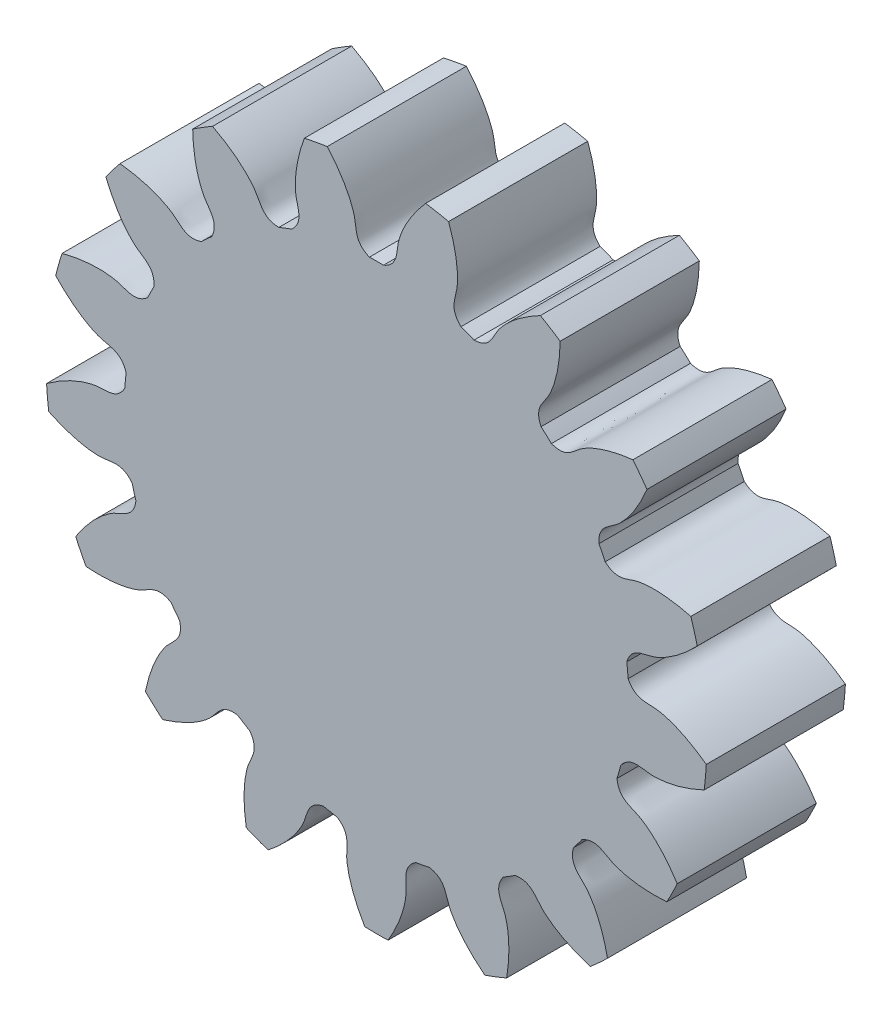
from build123d import *

# Parameters (mm, degrees)
SKETCH_1_R               = 9.5
EXTRUDE_1_DEPTH          = 4
CUT_EXTRUDE_1_DEPTH      = 15.017845769
PATTERN_CIRCULAR_1_COUNT = 17


with BuildPart() as part:
    # 草图1 → 凸台-拉伸1 (new body)
    with BuildSketch(Plane.XY):
        Circle(SKETCH_1_R)
    extrude(amount=EXTRUDE_1_DEPTH)

    # 草图2 → 切除-拉伸1 (cut, through all)
    with BuildSketch(Plane.XY):
        with BuildLine():
            ThreePointArc((0.201693747, 7.247193914), (0, 7.25), (-0.201693747, 7.247193914))
            add(Edge.make_bspline(
                [(-0.201693747, 7.247193914), (-0.62787974, 7.424822021), (-0.566195378, 7.754813407), (-0.638305605, 8.064824138), (-0.644975734, 8.091150595), (-0.653018503, 8.120419314), (-0.66255059, 8.152585333), (-0.673691778, 8.187599364), (-0.68655908, 8.225408757), (-0.701268445, 8.265957251), (-0.717934112, 8.309185094), (-0.736668679, 8.355029064), (-0.757582964, 8.40342252), (-0.780785927, 8.454295441), (-0.806384576, 8.507574481), (-0.834483875, 8.563183015), (-0.865186662, 8.621041194), (-0.898593556, 8.681066), (-0.934802876, 8.7431713), (-0.973910555, 8.80726791), (-1.016010058, 8.873263654), (-1.0611923, 8.941063427), (-1.109545569, 9.010569262), (-1.161155445, 9.081680395), (-1.216104726, 9.154293339), (-1.274473352, 9.228301949), (-1.336338335, 9.303597503), (-1.401773683, 9.380068769), (-1.470850337, 9.45760209), (-1.543636099, 9.536081455), (-1.62019557, 9.615388585), (-1.700590083, 9.695403013), (-1.784877646, 9.776002168), (-1.873112879, 9.85706146), (-1.965346959, 9.938454365), (-2.061627565, 10.020052519), (-2.161998824, 10.1017258), (-2.266501261, 10.183342424), (-2.375171749, 10.264769036), (-2.488043464, 10.345870806), (-2.605145847, 10.426511519), (-2.726504534, 10.506553675), (-2.895821635, 10.613430533), (-3.026576902, 10.690525971), (-3.115645833, 10.740719118)],
                knots=[0, 0, 0, 0, 0.193882922, 0.199023975, 0.204850501, 0.211362501, 0.218559975, 0.226442923, 0.235011345, 0.24426524, 0.254204608, 0.264829451, 0.276139767, 0.288135557, 0.300816821, 0.314183558, 0.328235769, 0.342973453, 0.358396612, 0.374505244, 0.39129935, 0.408778929, 0.426943982, 0.445794509, 0.46533051, 0.485551984, 0.506458932, 0.528051354, 0.550329249, 0.573292619, 0.596941461, 0.621275778, 0.646295568, 0.672000832, 0.69839157, 0.725467781, 0.753229466, 0.781676625, 0.810809257, 0.840627364, 0.871130943, 0.902319997, 0.934194524, 1, 1, 1, 1], degree=3))
            ThreePointArc((-3.115645833, 10.740719118), (0, 11.183483184), (3.115645833, 10.740719118))
            add(Edge.make_bspline(
                [(0.201693747, 7.247193914), (0.62787974, 7.424822021), (0.566195378, 7.754813407), (0.638305605, 8.064824138), (0.644975734, 8.091150595), (0.653018503, 8.120419314), (0.66255059, 8.152585333), (0.673691778, 8.187599364), (0.68655908, 8.225408757), (0.701268445, 8.265957251), (0.717934112, 8.309185094), (0.736668679, 8.355029064), (0.757582964, 8.40342252), (0.780785927, 8.454295441), (0.806384576, 8.507574481), (0.834483875, 8.563183015), (0.865186662, 8.621041194), (0.898593556, 8.681066), (0.934802876, 8.7431713), (0.973910555, 8.80726791), (1.016010058, 8.873263654), (1.0611923, 8.941063427), (1.109545569, 9.010569262), (1.161155445, 9.081680395), (1.216104726, 9.154293339), (1.274473352, 9.228301949), (1.336338335, 9.303597503), (1.401773683, 9.380068769), (1.470850337, 9.45760209), (1.543636099, 9.536081455), (1.62019557, 9.615388585), (1.700590083, 9.695403013), (1.784877646, 9.776002168), (1.873112879, 9.85706146), (1.965346959, 9.938454365), (2.061627565, 10.020052519), (2.161998824, 10.1017258), (2.266501261, 10.183342424), (2.375171749, 10.264769036), (2.488043464, 10.345870806), (2.605145847, 10.426511519), (2.726504534, 10.506553675), (2.895821635, 10.613430533), (3.026576902, 10.690525971), (3.115645833, 10.740719118)],
                knots=[0, 0, 0, 0, 0.193882922, 0.199023975, 0.204850501, 0.211362501, 0.218559975, 0.226442923, 0.235011345, 0.24426524, 0.254204608, 0.264829451, 0.276139767, 0.288135557, 0.300816821, 0.314183558, 0.328235769, 0.342973453, 0.358396612, 0.374505244, 0.39129935, 0.408778929, 0.426943982, 0.445794509, 0.46533051, 0.485551984, 0.506458932, 0.528051354, 0.550329249, 0.573292619, 0.596941461, 0.621275778, 0.646295568, 0.672000832, 0.69839157, 0.725467781, 0.753229466, 0.781676625, 0.810809257, 0.840627364, 0.871130943, 0.902319997, 0.934194524, 1, 1, 1, 1], degree=3))
        make_face()
    cut_extrude_1 = extrude(amount=CUT_EXTRUDE_1_DEPTH, mode=Mode.SUBTRACT)

    # 阵列(圆周)1: 切除-拉伸1 ×17 about axis
    pattern_circular_1_axis = Axis((0, 0, -1.5), (0, 0, 1))
    for i in range(1, PATTERN_CIRCULAR_1_COUNT):
        add(cut_extrude_1.rotate(pattern_circular_1_axis, i * 360 / PATTERN_CIRCULAR_1_COUNT), mode=Mode.SUBTRACT)


solid = part.part
